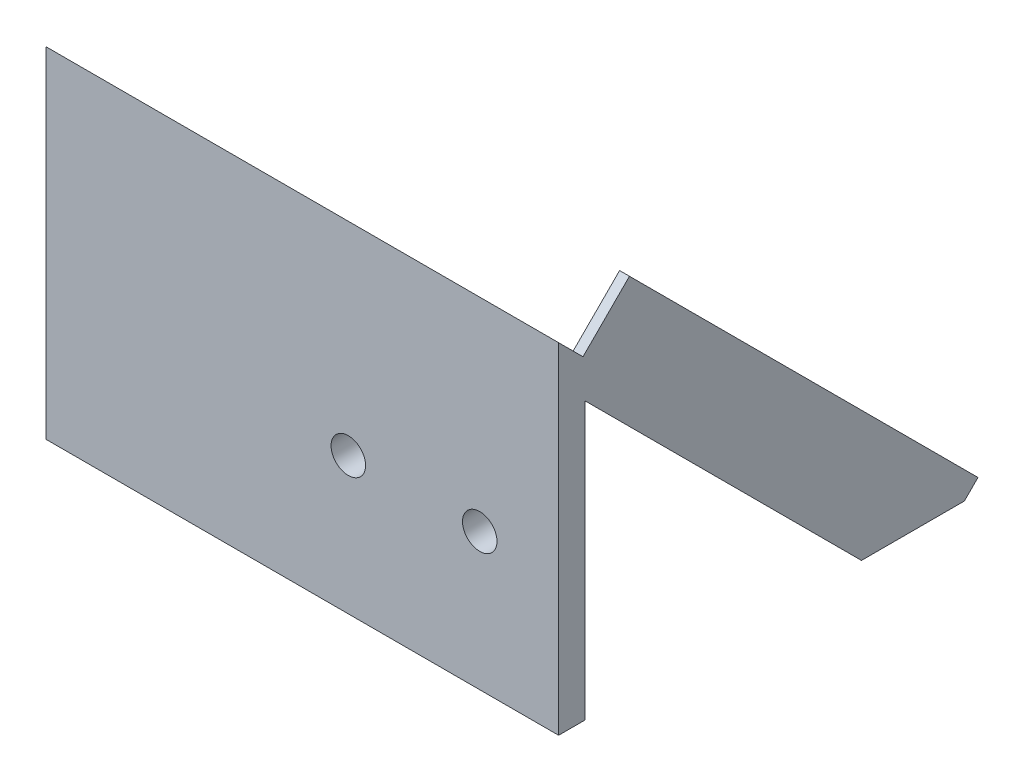
from build123d import *

# Parameters (mm, degrees)
BOSS_EXTRUDE1_DEPTH = 78
SKETCH2_W           = 1.5
SKETCH2_H           = 75
BOSS_EXTRUDE2_DEPTH = 10
CUT_EXTRUDE1_REACH  = 119.339
SKETCH3_R           = 2.625
SKETCH4_W           = 78
SKETCH4_H           = 5
CUT_EXTRUDE2_DEPTH  = 118.338622692


with BuildPart() as part:
    # Sketch1 → Boss-Extrude1 (new body)
    with BuildSketch(Plane(origin=(0, 0, 0), x_dir=(0, 0, -1), z_dir=(1, 0, 0))):
        Polygon((0, 0), (0, 56.74), (56.74, 0), (51.08, 0), (4, 47.08), (4, 0), align=None)
    extrude(amount=BOSS_EXTRUDE1_DEPTH)

    # Sketch2 → Boss-Extrude2 (add)
    with BuildSketch(Plane(origin=(0, 28.37, -28.37), x_dir=(1, 0, 0), z_dir=(0, 0.7071067811865482, -0.7071067811865468))):
        with Locations((77.25, 2.621238765)):
            Rectangle(SKETCH2_W, SKETCH2_H)
    extrude(amount=BOSS_EXTRUDE2_DEPTH)

    # Sketch3 → Cut-Extrude1 (cut, up to next)
    with BuildSketch(Plane.XY, mode=Mode.PRIVATE) as cut_extrude1_sk1:
        with Locations((66, 25.86)):
            Circle(SKETCH3_R)
    cut_extrude1_tool1 = extrude(cut_extrude1_sk1.sketch, amount=-CUT_EXTRUDE1_REACH, mode=Mode.PRIVATE) & part.part
    # Sketch3 → Cut-Extrude1 (cut, up to next)
    with BuildSketch(Plane.XY, mode=Mode.PRIVATE) as cut_extrude1_sk2:
        with Locations((46, 25.86)):
            Circle(SKETCH3_R)
    cut_extrude1_tool2 = extrude(cut_extrude1_sk2.sketch, amount=-CUT_EXTRUDE1_REACH, mode=Mode.PRIVATE) & part.part
    add(cut_extrude1_tool1.solids().sort_by_distance((66, 25.86, 0))[0], mode=Mode.SUBTRACT)
    add(cut_extrude1_tool2.solids().sort_by_distance((46, 25.86, 0))[0], mode=Mode.SUBTRACT)

    # Sketch4 → Cut-Extrude2 (cut, through all)
    with BuildSketch(Plane.XY):
        with Locations((39, 2.5)):
            Rectangle(SKETCH4_W, SKETCH4_H)
    extrude(amount=-CUT_EXTRUDE2_DEPTH, mode=Mode.SUBTRACT)


solid = part.part
